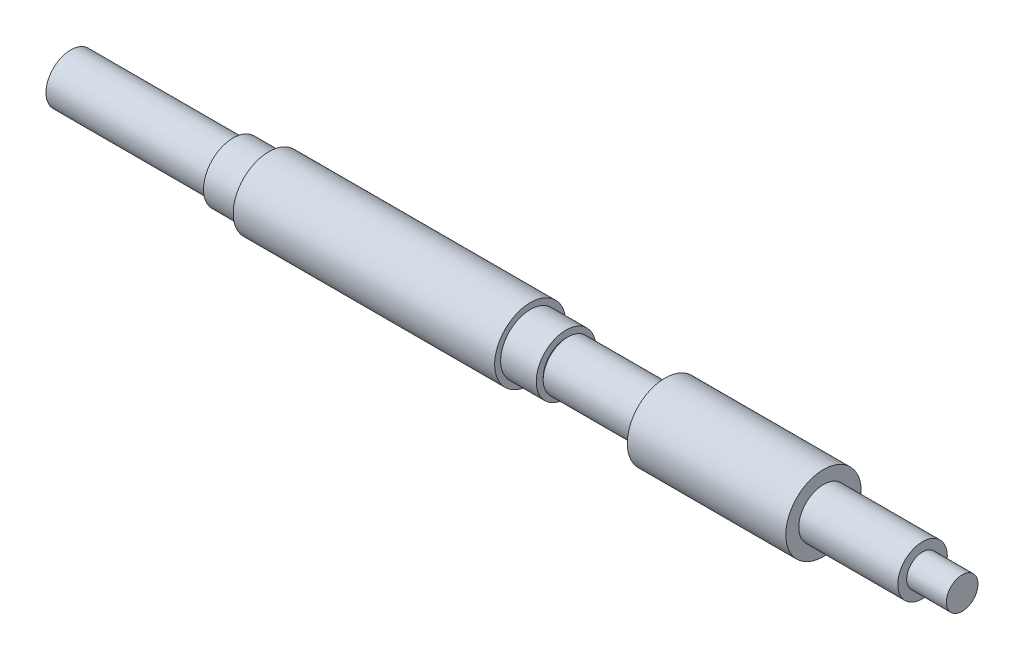
from build123d import *

# Parameters (mm, degrees)
SKETCH_1_R          = 12.5
EXTRUDE_1_DEPTH     = 100
SKETCH_2_R          = 15
EXTRUDE_2_DEPTH     = 18
SKETCH_3_R          = 18
EXTRUDE_3_DEPTH     = 132
EXTRUDE_START       = 18
SKETCH_4_R          = 15
EXTRUDE_4_DEPTH     = 18
SKETCH_5_R          = 12.5
EXTRUDE_5_DEPTH     = 50
SKETCH_6_R          = 19.05
EXTRUDE_6_DEPTH     = 80
SKETCH_7_R          = 12.5
EXTRUDE_7_DEPTH     = 50
SKETCH_9_R          = 8
EXTRUDE_8_DEPTH     = 20
CUT_EXTRUDE_START   = 1
SKETCH_11_R         = 12.5
SKETCH_11_R_2       = 11.5
CUT_EXTRUDE_2_DEPTH = 1
SKETCH_12_R         = 12.5
SKETCH_12_R_2       = 11.5
CUT_EXTRUDE_3_DEPTH = 1


with BuildPart() as part:
    # 草图1 → 凸台-拉伸1 (new body)
    with BuildSketch(Plane(origin=(0, 0, 0), x_dir=(0, 0, -1), z_dir=(1, 0, 0))):
        Circle(SKETCH_1_R)
    extrude(amount=EXTRUDE_1_DEPTH)

    # 草图2 → 凸台-拉伸2 (add)
    with BuildSketch(Plane(origin=(100, 0, 0), x_dir=(0, 0, -1), z_dir=(1, 0, 0))):
        Circle(SKETCH_2_R)
    extrude(amount=-EXTRUDE_2_DEPTH)

    # 草图3 → 凸台-拉伸3 (add)
    with BuildSketch(Plane(origin=(100, 0, 0), x_dir=(0, 0, -1), z_dir=(1, 0, 0))):
        Circle(SKETCH_3_R)
    extrude(amount=EXTRUDE_3_DEPTH)

    # 草图4 → 凸台-拉伸4 (add)
    with BuildSketch(Plane(origin=(232, 0, 0), x_dir=(0, 0, -1), z_dir=(1, 0, 0)).offset(EXTRUDE_START)):
        Circle(SKETCH_4_R)
    extrude(amount=-EXTRUDE_4_DEPTH)

    # 草图5 → 凸台-拉伸5 (add)
    with BuildSketch(Plane(origin=(250, 0, 0), x_dir=(0, 0, -1), z_dir=(1, 0, 0))):
        Circle(SKETCH_5_R)
    extrude(amount=EXTRUDE_5_DEPTH)

    # 草图6 → 凸台-拉伸6 (add)
    with BuildSketch(Plane(origin=(300, 0, 0), x_dir=(0, 0, -1), z_dir=(1, 0, 0))):
        Circle(SKETCH_6_R)
    extrude(amount=EXTRUDE_6_DEPTH)

    # 草图7 → 凸台-拉伸7 (add)
    with BuildSketch(Plane(origin=(380, 0, 0), x_dir=(0, 0, -1), z_dir=(1, 0, 0))):
        Circle(SKETCH_7_R)
    extrude(amount=EXTRUDE_7_DEPTH)

    # 草图9 → 凸台-拉伸8 (add)
    with BuildSketch(Plane(origin=(430, 0, 0), x_dir=(0, 0, -1), z_dir=(1, 0, 0))):
        Circle(SKETCH_9_R)
    extrude(amount=EXTRUDE_8_DEPTH)


with BuildPart() as body_2:
    # Split Bodies 1: the piece on the far side of the plane
    add(part.part)
    split(bisect_by=Plane(origin=(300, 0, 0), x_dir=(0, 0, -1), z_dir=(-1, 0, 0)), keep=Keep.BOTTOM)


with BuildPart() as part_1:
    add(part.part)

    # Split Bodies 1
    split(bisect_by=Plane(origin=(300, 0, 0), x_dir=(0, 0, -1), z_dir=(-1, 0, 0)), keep=Keep.TOP)

    # 草图11 → 切除-拉伸2 (cut)
    with BuildSketch(Plane.ZY.offset(-82).offset(CUT_EXTRUDE_START)):
        with Locations(Location((0, 0, 0), (0, 0, 180))):
            Circle(SKETCH_11_R)
        Circle(SKETCH_11_R_2, mode=Mode.SUBTRACT)
    extrude(amount=-CUT_EXTRUDE_2_DEPTH, mode=Mode.SUBTRACT)

    # 草图12 → 切除-拉伸3 (cut)
    with BuildSketch(Plane(origin=(250, 0, 0), x_dir=(0, 0, -1), z_dir=(1, 0, 0))):
        Circle(SKETCH_12_R)
        with Locations(Location((0, 0, 0), (0, 0, 180))):
            Circle(SKETCH_12_R_2, mode=Mode.SUBTRACT)
    extrude(amount=CUT_EXTRUDE_3_DEPTH, mode=Mode.SUBTRACT)


solid = Compound([body_2.part, part_1.part])
